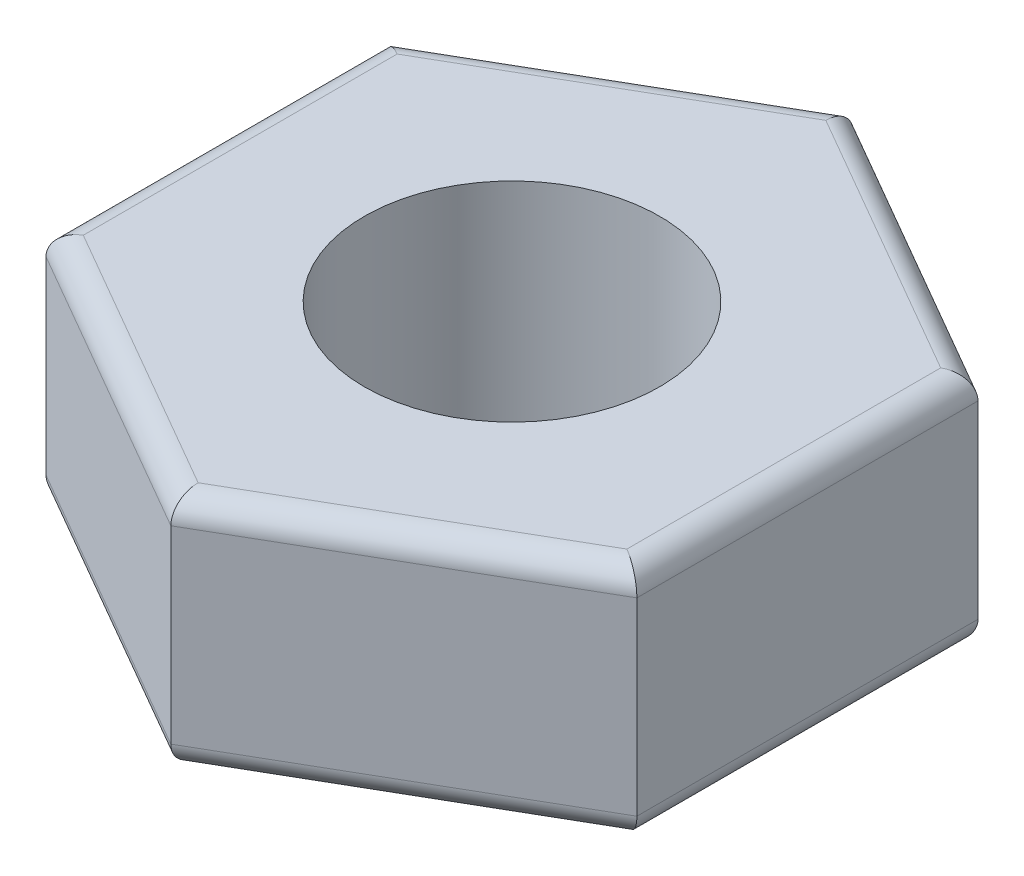
from build123d import *

# Parameters (mm, degrees)
SKETCH1_R           = 2.5
BOSS_EXTRUDE1_DEPTH = 4
FILLET1_R           = 0.4


with BuildPart() as part:
    # Sketch1 → Boss-Extrude1 (new body)
    with BuildSketch(Plane(origin=(0, 0, 0), x_dir=(1, 0, 0), z_dir=(0, 1, 0))):
        Polygon((0, 5.773502692), (-5, 2.886751346), (-5, -2.886751346), (0, -5.773502692), (5, -2.886751346), (5, 2.886751346), align=None)
        with Locations(Location((0, 0, 0), (0, 0, 270))):
            Circle(SKETCH1_R, mode=Mode.SUBTRACT)
    extrude(amount=BOSS_EXTRUDE1_DEPTH)

    # Fillet1
    fillet1_edges = [part.edges().sort_by_distance(p)[0] for p in [
        (-5, 4, 0),
        (-2.5, 4, 4.330127019),
        (2.5, 4, 4.330127019),
        (5, 4, 0),
        (2.5, 4, -4.330127019),
        (5, 0, 0),
        (2.5, 0, 4.330127019),
        (-2.5, 0, 4.330127019),
        (-5, 0, 0),
        (-2.5, 0, -4.330127019),
        (2.5, 0, -4.330127019),
        (-2.5, 4, -4.330127019),
    ]]
    fillet(fillet1_edges, radius=FILLET1_R)


solid = part.part
